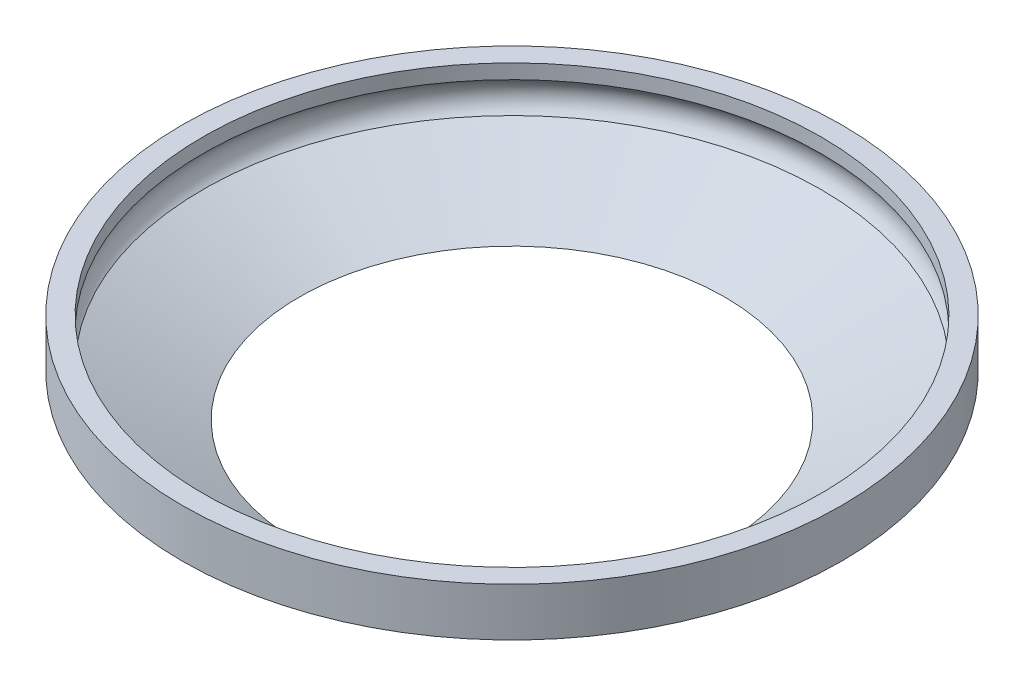
from build123d import *

# Parameters (mm, degrees)
SKETCH4_R          = 21
CUT_EXTRUDE1_DEPTH = 1.37
CUT_EXTRUDE1_DRAFT = -50
SKETCH5_W          = 2
SKETCH5_H          = 0.6


with BuildPart() as part:
    # Sketch3 → Revolve2 (revolve)
    with BuildSketch(Plane.XY, mode=Mode.PRIVATE) as revolve2_sk:
        with BuildLine():
            Line((-28, -2.8), (-28, -3.8))
            Line((-28, -3.8), (-21.291666667, -6.8))
            Line((-21.291666667, -6.8), (-19.589543983, -9.313904271))
            Line((-19.589543983, -9.313904271), (-31.8, -3.853327667))
            Line((-31.8, -3.853327667), (-31.8, 1.4))
            Line((-31.8, 1.4), (-29.8, 1.4))
            Line((-29.8, 1.4), (-29.8, -0.6))
            ThreePointArc((-29.8, -0.6), (-30.5, -2.1), (-29.8, -3.6))
            Line((-29.8, -3.6), (-29.8, -2.8))
            Line((-29.8, -2.8), (-28, -2.8))
        make_face()
    revolve(revolve2_sk.sketch.rotate(Axis((0, 0, 0), (0, 1, 0)), 270), axis=Axis((0, 0, 0), (0, 1, 0)))


with BuildPart() as cut_extrude1_tool:
    # Sketch4 → Cut-Extrude1 (with draft: the straight prism first)
    with BuildSketch(Plane(origin=(0, -9.313904271, 0), x_dir=(1, 0, 0), z_dir=(0, 1, 0))):
        Circle(SKETCH4_R)
    extrude(amount=CUT_EXTRUDE1_DEPTH)
    # Cut-Extrude1: the draft: its side faces are tilted about the plane it starts from
    cut_extrude1_sides = [cut_extrude1_tool.faces().sort_by_distance(p)[0] for p in [
        (-21, -8.628904271, 0),
    ]]
    draft(cut_extrude1_sides, Plane(origin=(0, -9.313904271, 0), x_dir=(1, 0, 0), z_dir=(0, 1, 0)), CUT_EXTRUDE1_DRAFT)


with BuildPart() as part_1:
    add(part.part)

    # Cut-Extrude1: cut by cut_extrude1_tool
    add(cut_extrude1_tool.part, mode=Mode.SUBTRACT)

    # Sketch5 → Cut-Revolve1 (revolve, cut)
    with BuildSketch(Plane.XY, mode=Mode.PRIVATE) as cut_revolve1_sk:
        with Locations((-30.8, 1.1)):
            Rectangle(SKETCH5_W, SKETCH5_H)
    revolve(cut_revolve1_sk.sketch.rotate(Axis((0, 0, 0), (0, 1, 0)), 270), axis=Axis((0, 0, 0), (0, 1, 0)), mode=Mode.SUBTRACT)

    # Sketch6 → Cut-Revolve2 (revolve, cut)
    with BuildSketch(Plane.XY, mode=Mode.PRIVATE) as cut_revolve2_sk:
        Polygon((-28, -3.8), (-29.8, -2.8), (-28, -2.8), align=None)
    revolve(cut_revolve2_sk.sketch.rotate(Axis((0, 0, 0), (0, 1, 0)), 90), axis=Axis((0, 0, 0), (0, 1, 0)), mode=Mode.SUBTRACT)

    # Sketch7 → Cut-Revolve3 (revolve, cut)
    with BuildSketch(Plane.XY, mode=Mode.PRIVATE) as cut_revolve3_sk:
        Polygon((-28, -3.8), (-21.291666667, -6.8), (-20.51714815, -7.943904271), (-29.8, -3.6), (-29.8, -2.8), align=None)
    revolve(cut_revolve3_sk.sketch.rotate(Axis((0, 0, 0), (0, 1, 0)), 90), axis=Axis((0, 0, 0), (0, 1, 0)), mode=Mode.SUBTRACT)


solid = part_1.part
